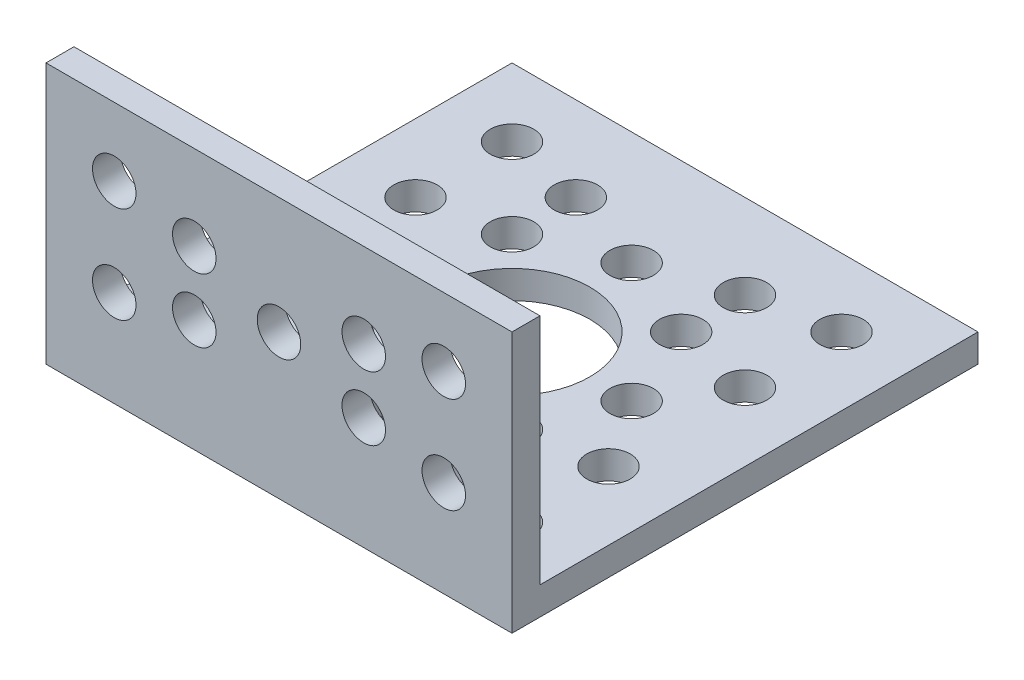
from build123d import *

# Parameters (mm, degrees)
SKETCH1_W                = 38.1
SKETCH1_H                = 38.1
BOSS_EXTRUDE1_DEPTH      = 21.336
SKETCH2_W                = 35.814
SKETCH2_H                = 19.05
CUT_EXTRUDE1_DEPTH       = 48.641761051
HOLE1_D                  = 12.7254
HOLE1_DEPTH              = 21.336
M3_CLEARANCE_HOLE1_D     = 3.556
M3_CLEARANCE_HOLE1_DEPTH = 21.336
M3_CLEARANCE_HOLE2_D     = 3.556
M3_CLEARANCE_HOLE2_DEPTH = 38.1


with BuildPart() as part:
    # Sketch1 → Boss-Extrude1 (new body)
    with BuildSketch(Plane(origin=(0, 21.336, 0), x_dir=(1, 0, 0), z_dir=(0, 1, 0))):
        Rectangle(SKETCH1_W, SKETCH1_H)
    extrude(amount=-BOSS_EXTRUDE1_DEPTH)

    # Sketch2 → Cut-Extrude1 (cut, through all)
    with BuildSketch(Plane.ZY.offset(19.05)):
        with Locations((-1.143, 11.811)):
            Rectangle(SKETCH2_W, SKETCH2_H)
    extrude(amount=-CUT_EXTRUDE1_DEPTH, mode=Mode.SUBTRACT)

    # Hole1
    with Locations(Plane(origin=(0, 0, 0), x_dir=(-1, 0, 0), z_dir=(0, -1, 0))):
        with Locations((0, 0)):
            Hole(HOLE1_D / 2, depth=HOLE1_DEPTH)

    # M3 Clearance Hole1
    with Locations(Plane(origin=(0, 0, 0), x_dir=(-1, 0, 0), z_dir=(0, -1, 0))):
        with Locations((6.914797213, -12.135202787), (13.470384182, 13.470384182), (-13.470384182, 13.470384182), (0, -9.779), (6.914797213, -6.914797213), (9.779, 0), (6.914797213, 6.914797213), (0, 9.779), (-6.914797213, 6.914797213), (-9.779, 0), (-6.914797213, -6.914797213), (-13.470384182, -5.579615818), (-6.914797213, -12.135202787), (-13.470384182, -13.470384182), (-13.470384182, 5.579615818), (-6.914797213, 12.135202787), (13.470384182, 5.579615818), (6.914797213, 12.135202787), (13.470384182, -5.579615818), (13.470384182, -13.470384182)):
            Hole(M3_CLEARANCE_HOLE1_D / 2, depth=M3_CLEARANCE_HOLE1_DEPTH)

    # M3 Clearance Hole2
    with Locations(Plane.XY.offset(19.05)):
        with Locations((-6.92785, 14.42212), (13.470382, 7.86638), (13.470382, 15.75562), (6.92785, 9.19988), (6.92785, 14.42212), (0, 11.811), (-13.470382, 7.86638), (-13.470382, 15.75562), (-6.92785, 9.19988)):
            Hole(M3_CLEARANCE_HOLE2_D / 2, depth=M3_CLEARANCE_HOLE2_DEPTH)


solid = part.part
